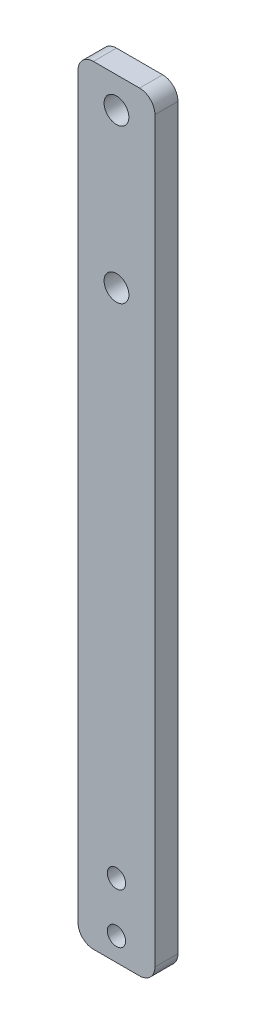
from build123d import *

# Parameters (mm, degrees)
SKETCH1_W           = 5
SKETCH1_H           = 50
SKETCH1_R           = 0.59563
SKETCH1_R_2         = 0.80645
BOSS_EXTRUDE1_DEPTH = 1.5
FILLET1_R           = 1


with BuildPart() as part:
    # Sketch1 → Boss-Extrude1 (new body)
    with BuildSketch(Plane.XY):
        with Locations((0, 21.875)):
            Rectangle(SKETCH1_W, SKETCH1_H)
        with Locations((0, 1.625)):
            Circle(SKETCH1_R, mode=Mode.SUBTRACT)
        with Locations((0, -1.625)):
            Circle(SKETCH1_R, mode=Mode.SUBTRACT)
        with Locations((0, 44.875)):
            Circle(SKETCH1_R_2, mode=Mode.SUBTRACT)
        with Locations((0, 34.875)):
            Circle(SKETCH1_R_2, mode=Mode.SUBTRACT)
    extrude(amount=BOSS_EXTRUDE1_DEPTH)

    # Fillet1
    fillet1_edges = [part.edges().sort_by_distance(p)[0] for p in [
        (2.5, -3.125, 0.75),
        (-2.5, -3.125, 0.75),
        (-2.5, 46.875, 0.75),
        (2.5, 46.875, 0.75),
    ]]
    fillet(fillet1_edges, radius=FILLET1_R)


solid = part.part
